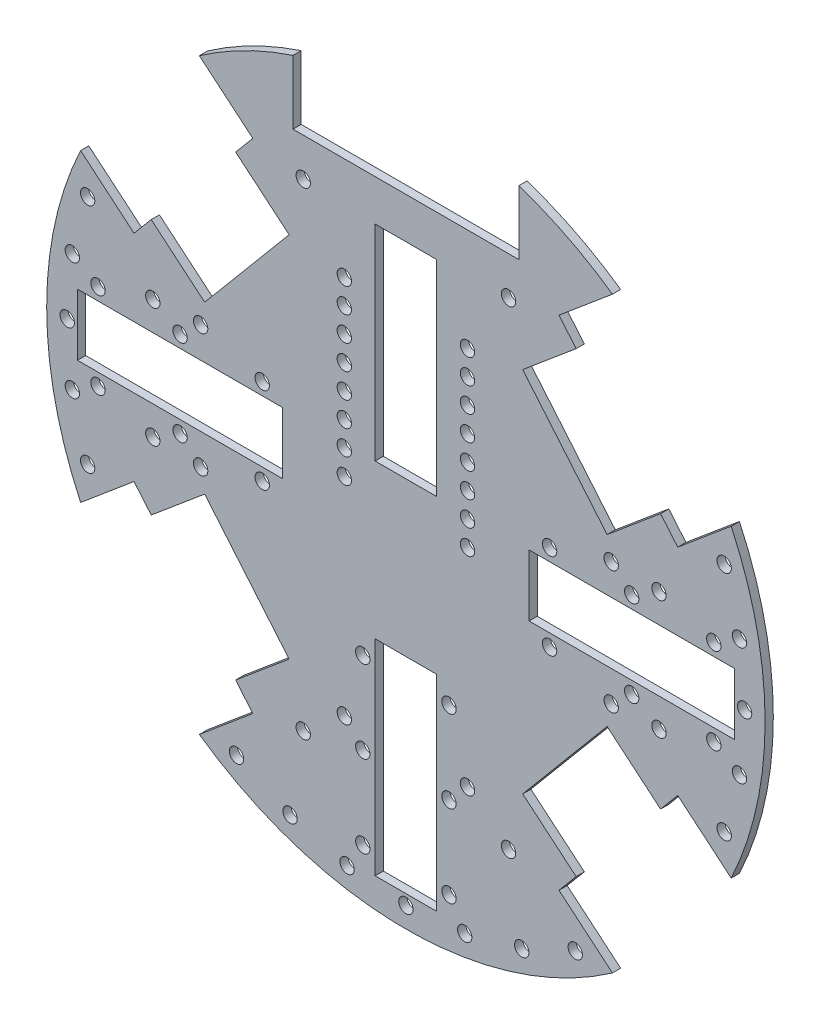
from build123d import *

# Parameters (mm, degrees)
SKETCH1_R                                  = 87.5
BOSS_EXTRUDE1_DEPTH                        = 2
SKETCH3_R                                  = 1.75
CUT_EXTRUDE1_DEPTH                         = 124.759848093
MIRROR1_AT_THE_SECOND_PLANE_COPY_1_SKETC_R = 1.75
MIRROR1_AT_THE_SECOND_PLANE_COPY_1_DEPTH   = 124.759848093
CUT_EXTRUDE2_DEPTH                         = 124.759848093
CUT_EXTRUDE2_DEPTH_BACK                    = 124.759848093
SKETCH4_W                                  = 55
SKETCH4_H                                  = 40
SKETCH5_R                                  = 1.75
CUT_EXTRUDE3_DEPTH                         = 124.759848093
SKETCH8_W                                  = 50
SKETCH8_H                                  = 15
CUT_EXTRUDE4_DEPTH                         = 124.759848093
SKETCH9_R                                  = 1.75
CUT_EXTRUDE5_DEPTH                         = 124.759848093
CIRPATTERN1_COUNT                          = 3
CIRPATTERN1_ANGLE                          = 180
SKETCH10_W                                 = 15
SKETCH10_H                                 = 50
CUT_EXTRUDE6_DEPTH                         = 124.759848093
SKETCH11_R                                 = 1.75
CUT_EXTRUDE7_DEPTH                         = 124.759848093
SKETCH12_R                                 = 1.75
CUT_EXTRUDE8_DEPTH                         = 124.759848093
SKETCH13_R                                 = 1.75
CUT_EXTRUDE9_DEPTH                         = 124.759848093


with BuildPart() as part:
    # Sketch1 → Boss-Extrude1 (new body)
    with BuildSketch(Plane.XY):
        Circle(SKETCH1_R)
    extrude(amount=-BOSS_EXTRUDE1_DEPTH)

    # Sketch3 → Cut-Extrude1 (cut, through all)
    with BuildSketch(Plane.XY):
        with BuildLine():
            Line((-62.036781461, 31.168523814), (-49.014025927, 20.241134449))
            Line((-49.014025927, 20.241134449), (-28.444822418, 44.754556629))
            Line((-28.444822418, 44.754556629), (-41.467577951, 55.681945993))
            Line((-41.467577951, 55.681945993), (-37.289458488, 60.661234874))
            Line((-37.289458488, 60.661234874), (-50.312214021, 71.588624238))
            ThreePointArc((-50.312214021, 71.588624238), (-67.028888773, 56.243915848), (-79.237656457, 37.116624298))
            Line((-79.237656457, 37.116624298), (-66.214900923, 26.189234933))
            Line((-66.214900923, 26.189234933), (-62.036781461, 31.168523814))
        make_face()
        with Locations((-61.645137707, 14.522304568)):
            Circle(SKETCH3_R)
        with Locations((-25.006243955, 58.186837826)):
            Circle(SKETCH3_R)
    cut_extrude1 = extrude(amount=-CUT_EXTRUDE1_DEPTH, mode=Mode.SUBTRACT)

    # Mirror1: Cut-Extrude1 across plane
    add(cut_extrude1.mirror(Plane(origin=(0, 0, 0), x_dir=(0, 0, 1), z_dir=(1, 0, 0))), mode=Mode.SUBTRACT)

    # Mirror1 at the second plane: Cut-Extrude1 across plane
    add(cut_extrude1.mirror(Plane.ZX), mode=Mode.SUBTRACT)

    # Mirror1 at the second plane copy 1 sketc → Mirror1 at the second plane copy 1 (cut, through all)
    with BuildSketch(Plane(origin=(0, 0, 0), x_dir=(-1, 0, 0), z_dir=(0, 0, 1))):
        with BuildLine():
            Line((-62.036781461, 31.168523814), (-49.014025927, 20.241134449))
            Line((-49.014025927, 20.241134449), (-28.444822418, 44.754556629))
            Line((-28.444822418, 44.754556629), (-41.467577951, 55.681945993))
            Line((-41.467577951, 55.681945993), (-37.289458488, 60.661234874))
            Line((-37.289458488, 60.661234874), (-50.312214021, 71.588624238))
            ThreePointArc((-50.312214021, 71.588624238), (-67.028888773, 56.243915848), (-79.237656457, 37.116624298))
            Line((-79.237656457, 37.116624298), (-66.214900923, 26.189234933))
            Line((-66.214900923, 26.189234933), (-62.036781461, 31.168523814))
        make_face()
        with Locations((-61.645137707, 14.522304568)):
            Circle(MIRROR1_AT_THE_SECOND_PLANE_COPY_1_SKETC_R)
        with Locations((-25.006243955, 58.186837826)):
            Circle(MIRROR1_AT_THE_SECOND_PLANE_COPY_1_SKETC_R)
    extrude(amount=-MIRROR1_AT_THE_SECOND_PLANE_COPY_1_DEPTH, mode=Mode.SUBTRACT)

    # Sketch4 → Cut-Extrude2 (cut, two sides: drawn at the far end of the back side and taken through both)
    with BuildSketch(Plane.XY.offset(-CUT_EXTRUDE2_DEPTH_BACK)):
        with Locations((0, 87.5)):
            Rectangle(SKETCH4_W, SKETCH4_H)
    extrude(amount=CUT_EXTRUDE2_DEPTH + CUT_EXTRUDE2_DEPTH_BACK, mode=Mode.SUBTRACT)

    # Sketch5 → Cut-Extrude3 (cut, through all)
    with BuildSketch(Plane.XY):
        with Locations((-50, 15)):
            Circle(SKETCH5_R)
        with Locations((-50, -15)):
            Circle(SKETCH5_R)
    cut_extrude3 = extrude(amount=-CUT_EXTRUDE3_DEPTH, mode=Mode.SUBTRACT)

    # Sketch8 → Cut-Extrude4 (cut, through all)
    with BuildSketch(Plane.XY):
        with Locations((-55, 0)):
            Rectangle(SKETCH8_W, SKETCH8_H)
    cut_extrude4 = extrude(amount=-CUT_EXTRUDE4_DEPTH, mode=Mode.SUBTRACT)

    # Sketch9 → Cut-Extrude5 (cut, through all)
    with BuildSketch(Plane.XY):
        with Locations((-35, 10.5)):
            Circle(SKETCH9_R)
        with Locations((-35, -10.5)):
            Circle(SKETCH9_R)
        with Locations((-55, 10.5)):
            Circle(SKETCH9_R)
        with Locations((-55, -10.5)):
            Circle(SKETCH9_R)
        with Locations((-75, 10.5)):
            Circle(SKETCH9_R)
        with Locations((-75, -10.5)):
            Circle(SKETCH9_R)
    cut_extrude5 = extrude(amount=-CUT_EXTRUDE5_DEPTH, mode=Mode.SUBTRACT)

    # CirPattern1: Cut-Extrude3, Cut-Extrude4, Cut-Extrude5 ×3 about axis
    cirpattern1_axis = Axis((0, 0, 0), (0, 0, 1))
    add([cut_extrude3.rotate(cirpattern1_axis, i * CIRPATTERN1_ANGLE / (CIRPATTERN1_COUNT - 1)) for i in range(1, CIRPATTERN1_COUNT)], mode=Mode.SUBTRACT)
    add([cut_extrude4.rotate(cirpattern1_axis, i * CIRPATTERN1_ANGLE / (CIRPATTERN1_COUNT - 1)) for i in range(1, CIRPATTERN1_COUNT)], mode=Mode.SUBTRACT)
    add([cut_extrude5.rotate(cirpattern1_axis, i * CIRPATTERN1_ANGLE / (CIRPATTERN1_COUNT - 1)) for i in range(1, CIRPATTERN1_COUNT)], mode=Mode.SUBTRACT)

    # Sketch10 → Cut-Extrude6 (cut, through all)
    with BuildSketch(Plane.XY):
        with Locations((0, 32.5)):
            Rectangle(SKETCH10_W, SKETCH10_H)
    extrude(amount=-CUT_EXTRUDE6_DEPTH, mode=Mode.SUBTRACT)

    # Sketch11 → Cut-Extrude7 (cut, through all)
    with BuildSketch(Plane.XY):
        with Locations((-15, 42.5)):
            Circle(SKETCH11_R)
        with Locations((15, 42.5)):
            Circle(SKETCH11_R)
        with Locations((-15, 36.5)):
            Circle(SKETCH11_R)
        with Locations((15, 36.5)):
            Circle(SKETCH11_R)
        with Locations((-15, 30.5)):
            Circle(SKETCH11_R)
        with Locations((15, 30.5)):
            Circle(SKETCH11_R)
        with Locations((-15, 24.5)):
            Circle(SKETCH11_R)
        with Locations((15, 24.5)):
            Circle(SKETCH11_R)
        with Locations((-15, 18.5)):
            Circle(SKETCH11_R)
        with Locations((15, 18.5)):
            Circle(SKETCH11_R)
        with Locations((-15, 12.5)):
            Circle(SKETCH11_R)
        with Locations((15, 12.5)):
            Circle(SKETCH11_R)
        with Locations((-15, 6.5)):
            Circle(SKETCH11_R)
        with Locations((15, 6.5)):
            Circle(SKETCH11_R)
        with Locations((-15, 0.5)):
            Circle(SKETCH11_R)
        with Locations((15, 0.5)):
            Circle(SKETCH11_R)
    extrude(amount=-CUT_EXTRUDE7_DEPTH, mode=Mode.SUBTRACT)

    # Sketch12 → Cut-Extrude8 (cut, through all)
    with BuildSketch(Plane.XY):
        with Locations((-77.524641215, 28.216661824)):
            Circle(SKETCH12_R)
        with Locations((-81.246639624, 14.325974658)):
            Circle(SKETCH12_R)
        with Locations((-82.5, 0)):
            Circle(SKETCH12_R)
        with Locations((-81.246639624, -14.325974658)):
            Circle(SKETCH12_R)
        with Locations((-77.524641215, -28.216661824)):
            Circle(SKETCH12_R)
    cut_extrude8 = extrude(amount=-CUT_EXTRUDE8_DEPTH, mode=Mode.SUBTRACT)

    # Mirror2: Cut-Extrude8 across plane
    add(cut_extrude8.mirror(Plane(origin=(0, 0, 0), x_dir=(0, 0, 1), z_dir=(1, 0, 0))), mode=Mode.SUBTRACT)

    # Sketch13 → Cut-Extrude9 (cut, through all)
    with BuildSketch(Plane.XY):
        with Locations((-41.25, -71.447095812)):
            Circle(SKETCH13_R)
        with Locations((-28.216661824, -77.524641215)):
            Circle(SKETCH13_R)
        with Locations((-14.325974658, -81.246639624)):
            Circle(SKETCH13_R)
        with Locations((0, -82.5)):
            Circle(SKETCH13_R)
        with Locations((14.325974658, -81.246639624)):
            Circle(SKETCH13_R)
        with Locations((28.216661824, -77.524641215)):
            Circle(SKETCH13_R)
        with Locations((41.25, -71.447095812)):
            Circle(SKETCH13_R)
    extrude(amount=-CUT_EXTRUDE9_DEPTH, mode=Mode.SUBTRACT)


solid = part.part
